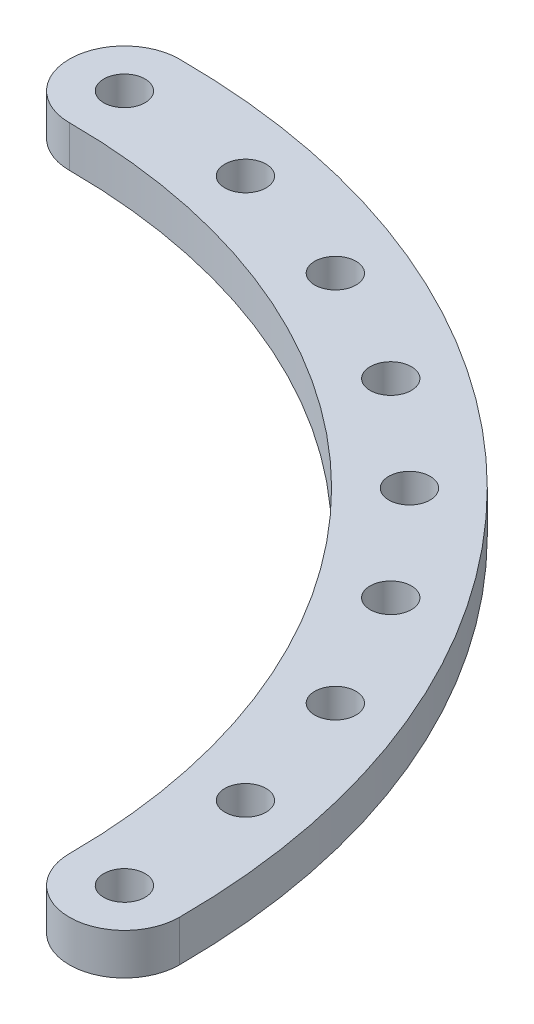
from build123d import *

# Parameters (mm, degrees)
SKETCH1_R           = 1.5
BOSS_EXTRUDE1_DEPTH = 3
CUT_EXTRUDE1_START  = -3
CUT_EXTRUDE1_DEPTH  = 3


with BuildPart() as part:
    # Sketch1 → Boss-Extrude1 (new body)
    with BuildSketch(Plane(origin=(0, 0, 0), x_dir=(1, 0, 0), z_dir=(0, 1, 0))):
        with BuildLine():
            Line((-5.292925578, 53.73997524), (-4.508788455, 45.778497427))
            ThreePointArc((-4.508788455, 45.778497427), (-2.257113019, 45.944590985), (0, 46))
            ThreePointArc((0, 46), (32.526911935, 32.526911935), (46, 0))
            ThreePointArc((46, 0), (45.944590985, -2.257113019), (45.778497427, -4.508788455))
            Line((45.778497427, -4.508788455), (53.73997524, -5.292925578))
            ThreePointArc((53.73997524, -5.292925578), (53.934954635, -2.649654414), (54, 0))
            ThreePointArc((54, 0), (36.264183562, 40.011360769), (-5.292925578, 53.73997524))
        make_face()
        with Locations(Location((50, 0, 0), (0, 0, 270))):
            Circle(SKETCH1_R, mode=Mode.SUBTRACT)
        with Locations(Location((49.03926402, 9.754516101, 0), (0, 0, 270))):
            Circle(SKETCH1_R, mode=Mode.SUBTRACT)
        with Locations(Location((46.193976626, 19.134171618, 0), (0, 0, 270))):
            Circle(SKETCH1_R, mode=Mode.SUBTRACT)
        with Locations(Location((0, 50, 0), (0, 0, 270))):
            Circle(SKETCH1_R, mode=Mode.SUBTRACT)
        with Locations(Location((9.754516101, 49.03926402, 0), (0, 0, 270))):
            Circle(SKETCH1_R, mode=Mode.SUBTRACT)
        with Locations(Location((19.134171618, 46.193976626, 0), (0, 0, 270))):
            Circle(SKETCH1_R, mode=Mode.SUBTRACT)
        with Locations(Location((35.355339059, 35.355339059, 0), (0, 0, 270))):
            Circle(SKETCH1_R, mode=Mode.SUBTRACT)
        with Locations(Location((41.573480615, 27.778511651, 0), (0, 0, 270))):
            Circle(SKETCH1_R, mode=Mode.SUBTRACT)
        with Locations(Location((27.778511651, 41.573480615, 0), (0, 0, 270))):
            Circle(SKETCH1_R, mode=Mode.SUBTRACT)
    extrude(amount=BOSS_EXTRUDE1_DEPTH)

    # Sketch2 → Cut-Extrude1 (cut)
    with BuildSketch(Plane(origin=(0, 3, 0), x_dir=(1, 0, 0), z_dir=(0, 1, 0)).offset(CUT_EXTRUDE1_START)):
        with BuildLine():
            ThreePointArc((1e-08, 46), (-4, 50.000000016), (4.3e-08, 54))
            ThreePointArc((4.3e-08, 54), (-2.649654392, 53.934954636), (-5.292925578, 53.73997524))
            Line((-5.292925578, 53.73997524), (-4.508788455, 45.778497427))
            ThreePointArc((-4.508788455, 45.778497427), (-2.257113014, 45.944590986), (1e-08, 46))
        make_face()
        with BuildLine():
            ThreePointArc((53.73997524, -5.292925578), (53.934954635, -2.649654414), (54, 0))
            ThreePointArc((54, 0), (49.999999885, -4), (46, 2.31e-07))
            ThreePointArc((46, 2.31e-07), (45.944590991, -2.257112904), (45.778497427, -4.508788455))
            Line((45.778497427, -4.508788455), (53.73997524, -5.292925578))
        make_face()
    extrude(amount=CUT_EXTRUDE1_DEPTH, mode=Mode.SUBTRACT)


solid = part.part
